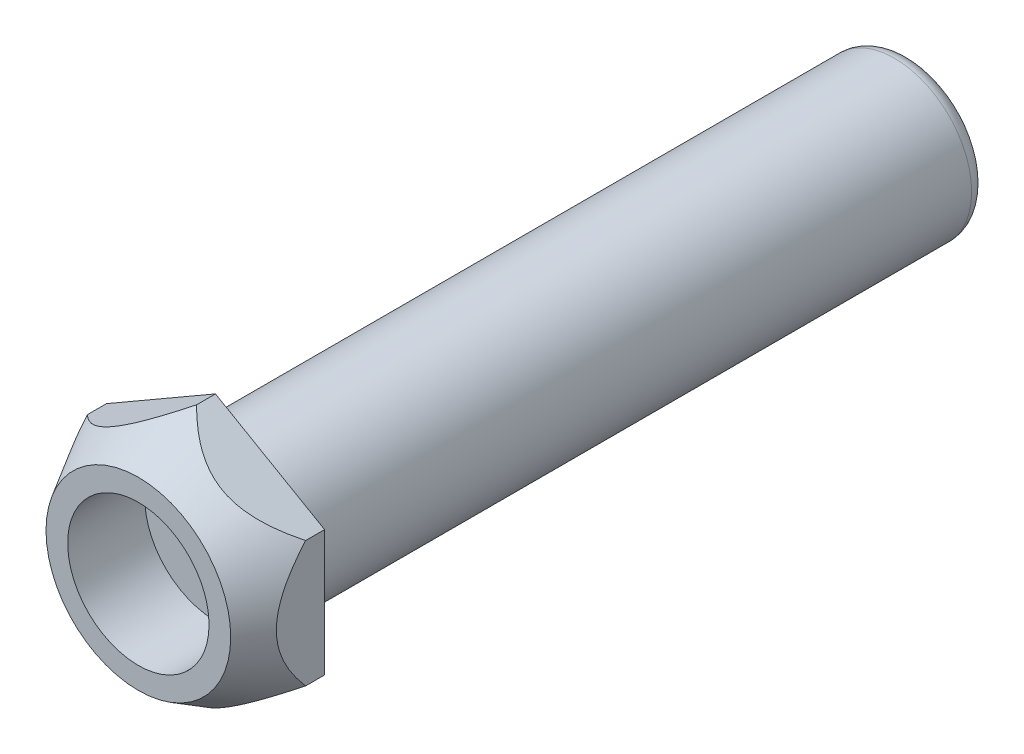
from build123d import *

# Parameters (mm, degrees)
SKETCH1_R           = 1
BOSS_EXTRUDE1_DEPTH = 9
BOSS_EXTRUDE2_DEPTH = 1
SKETCH3_R           = 0.916230728
CUT_EXTRUDE1_DEPTH  = 1
SKETCH5_OUTSIDE_W   = 8.162
SKETCH5_OUTSIDE_H   = 8.598
SKETCH5_OUTSIDE_R   = 1.19698552
CUT_EXTRUDE3_DEPTH  = 1
CUT_EXTRUDE3_DRAFT  = -30
FILLET1_R           = 0.2


with BuildPart() as part:
    # Sketch1 → Boss-Extrude1 (new body)
    with BuildSketch(Plane.XY):
        Circle(SKETCH1_R)
    extrude(amount=BOSS_EXTRUDE1_DEPTH)

    # Sketch2 → Boss-Extrude2 (add)
    with BuildSketch(Plane.XY.offset(9)):
        Polygon((0, 1.632320149), (-1.413630716, 0.816160075), (-1.413630716, -0.816160075), (0, -1.632320149), (1.413630716, -0.816160075), (1.413630716, 0.816160075), align=None)
    extrude(amount=BOSS_EXTRUDE2_DEPTH)

    # Sketch3 → Cut-Extrude1 (cut)
    with BuildSketch(Plane.XY.offset(10)):
        Circle(SKETCH3_R)
    extrude(amount=-CUT_EXTRUDE1_DEPTH, mode=Mode.SUBTRACT)


with BuildPart() as cut_extrude3_tool:
    # Sketch5 outside → Cut-Extrude3 (with draft: the straight prism first)
    with BuildSketch(Plane.XY.offset(10)):
        Rectangle(SKETCH5_OUTSIDE_W, SKETCH5_OUTSIDE_H)
        Circle(SKETCH5_OUTSIDE_R, mode=Mode.SUBTRACT)
    extrude(amount=-CUT_EXTRUDE3_DEPTH)
    # Cut-Extrude3: the draft: its side faces are tilted about the plane it starts from
    cut_extrude3_sides = [cut_extrude3_tool.faces().sort_by_distance(p)[0] for p in [
        (0, -4.299, 9.5),
        (4.081, 0, 9.5),
        (0, 4.299, 9.5),
        (-4.081, 0, 9.5),
        (-1.19698552, 0, 9.5),
    ]]
    draft(cut_extrude3_sides, Plane.XY.offset(10), CUT_EXTRUDE3_DRAFT)


with BuildPart() as part_1:
    add(part.part)

    # Cut-Extrude3: cut by cut_extrude3_tool
    add(cut_extrude3_tool.part, mode=Mode.SUBTRACT)

    # Fillet1
    fillet1_edges = [part_1.edges().sort_by_distance(p)[0] for p in [
        (-1, 0, 0),
    ]]
    fillet(fillet1_edges, radius=FILLET1_R)


solid = part_1.part
